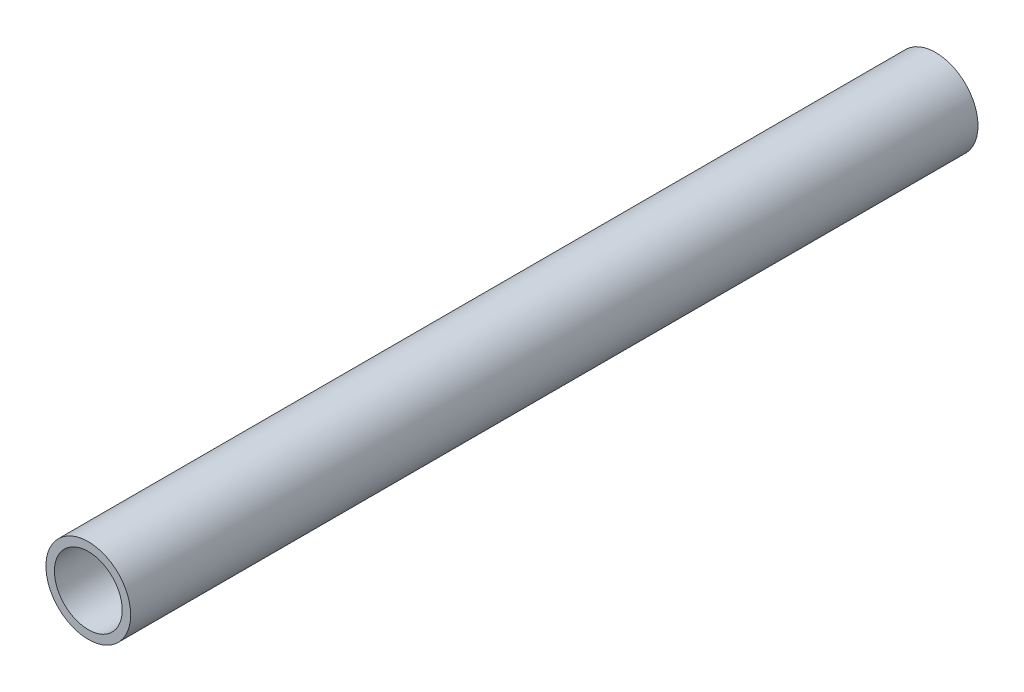
from build123d import *

# Parameters (mm, degrees)
SZKIC1_R                    = 15
SZKIC1_R_2                  = 12
DODANIE_WYCI_GNI_CIE1_DEPTH = 300


with BuildPart() as part:
    # Szkic1 → Dodanie-wyciągnięcie1 (new body)
    with BuildSketch(Plane.XY):
        Circle(SZKIC1_R)
        Circle(SZKIC1_R_2, mode=Mode.SUBTRACT)
    extrude(amount=DODANIE_WYCI_GNI_CIE1_DEPTH)


solid = part.part
